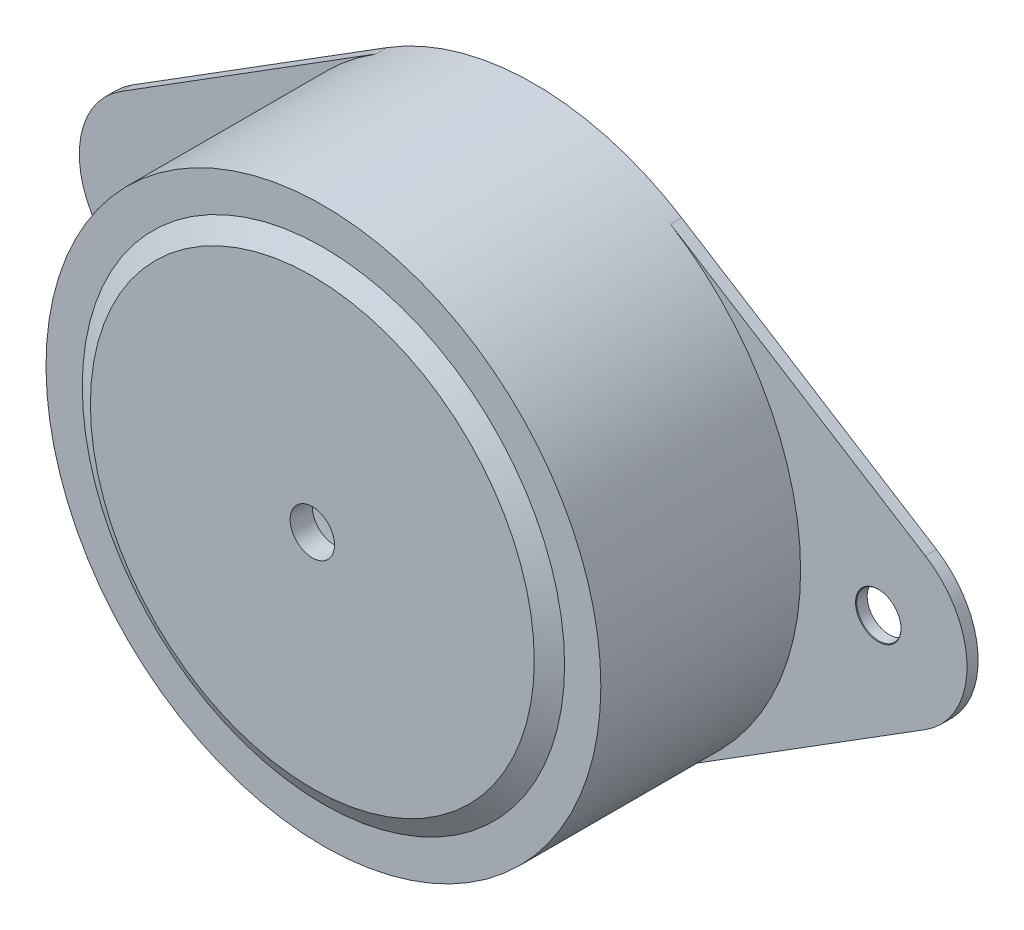
from build123d import *

# Parameters (mm, degrees)
BOSS_EXTRU_1_DEPTH         = 0.5
ESQUISSE2_R                = 12.5
BOSS_EXTRU_2_DEPTH         = 9
ESQUISSE4_R                = 1
ENL_V_MAT_EXTRU_1_DEPTH    = 26.617376915
TROU_TARAUD_M21_AT_2_COUNT = 2
TROU_TARAUD_M21_AT_2_PITCH = 32
ESQUISSE7_R                = 12
ENL_V_MAT_EXTRU_2_DEPTH    = 9
ESQUISSE8_R                = 12
ESQUISSE8_R_2              = 1
BOSS_EXTRU_3_DEPTH         = 0.5


with BuildPart() as part:
    # Esquisse1 → Boss.-Extru.1 (new body)
    with BuildSketch(Plane.XY):
        with BuildLine():
            Line((-18.125, 3.388860428), (-6.640625, 10.590188837))
            ThreePointArc((-6.640625, 10.590188837), (0, 12.5), (6.640625, 10.590188837))
            Line((6.640625, 10.590188837), (18.125, 3.388860428))
            ThreePointArc((18.125, 3.388860428), (20, 0), (18.125, -3.388860428))
            Line((18.125, -3.388860428), (6.640625, -10.590188837))
            ThreePointArc((6.640625, -10.590188837), (0, -12.5), (-6.640625, -10.590188837))
            Line((-6.640625, -10.590188837), (-18.125, -3.388860428))
            ThreePointArc((-18.125, -3.388860428), (-20, 0), (-18.125, 3.388860428))
        make_face()
    extrude(amount=BOSS_EXTRU_1_DEPTH)

    # Esquisse2 → Boss.-Extru.2 (add)
    with BuildSketch(Plane.XY.offset(0.5)):
        with Locations(Location((0, 0, 0), (0, 0, 122.089951256))):
            Circle(ESQUISSE2_R)
    extrude(amount=BOSS_EXTRU_2_DEPTH)

    # Esquisse3 → Révolution1 (revolve)
    with BuildSketch(Plane(origin=(0, 0, 0), x_dir=(0, 0, -1), z_dir=(1, 0, 0)), mode=Mode.PRIVATE) as r_volution1_sk:
        Polygon((-9.5, 10.866025404), (-10, 10), (-10, 0), (-9.5, 0), align=None)
    revolve(r_volution1_sk.sketch.rotate(Axis((0, 0, 2.055193474), (0, 0, 1)), 90), axis=Axis((0, 0, 2.055193474), (0, 0, 1)))

    # Esquisse4 → Enlèv. mat.-Extru.1 (cut, through all)
    with BuildSketch(Plane.XY.offset(10)):
        Circle(ESQUISSE4_R)
    extrude(amount=-ENL_V_MAT_EXTRU_1_DEPTH, mode=Mode.SUBTRACT)

    # Esquisse6 → Trou taraudé M21 (revolve, cut)
    with BuildSketch(Plane(origin=(16, 0, 0.5), x_dir=(0, -1, 0), z_dir=(1, 0, 0))):
        Polygon((0, 0), (0, 6.480688495), (0.8, 6), (0.8, 4), (1, 4), (1, 0.025), (1.025, 0), align=None)
    trou_taraud_m21 = revolve(axis=Axis((16, 0, 6.85), (0, 0, -1)), mode=Mode.SUBTRACT)

    # Trou taraudé M21 at 2: Trou taraudé M21 ×2
    with Locations(*[(-i * TROU_TARAUD_M21_AT_2_PITCH, 0, 0) for i in range(1, TROU_TARAUD_M21_AT_2_COUNT)]):
        add(trou_taraud_m21, mode=Mode.SUBTRACT)

    # Esquisse7 → Enlèv. mat.-Extru.2 (cut)
    with BuildSketch(Plane(origin=(0, 0, 0), x_dir=(-1, 0, 0), z_dir=(0, 0, -1))):
        Circle(ESQUISSE7_R)
    extrude(amount=-ENL_V_MAT_EXTRU_2_DEPTH, mode=Mode.SUBTRACT)

    # Esquisse8 → Boss.-Extru.3 (add)
    with BuildSketch(Plane(origin=(0, 0, 0), x_dir=(-1, 0, 0), z_dir=(0, 0, -1))):
        Circle(ESQUISSE8_R)
        with Locations(Location((0, 0, 0), (0, 0, 180))):
            Circle(ESQUISSE8_R_2, mode=Mode.SUBTRACT)
    extrude(amount=-BOSS_EXTRU_3_DEPTH)


solid = part.part
